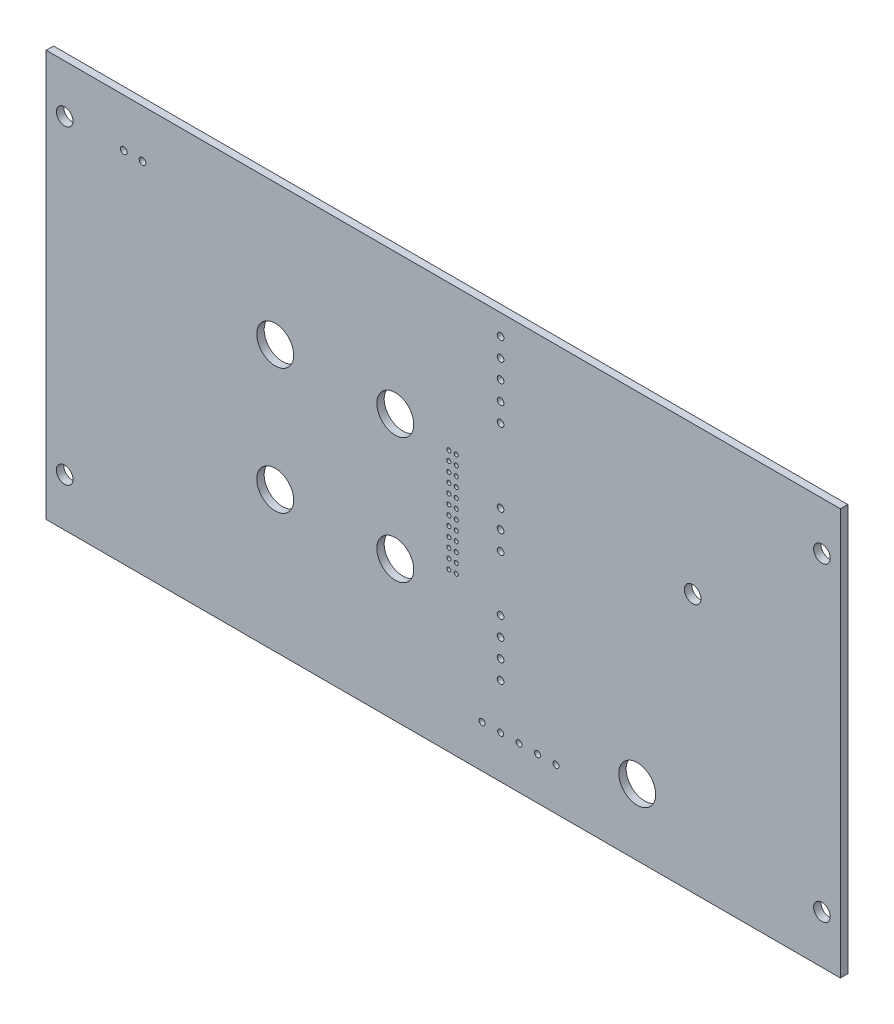
from build123d import *

# Parameters (mm, degrees)
SKETCH_1_W                  = 215
SKETCH_1_H                  = 110
SKETCH_1_R                  = 2.25
SKETCH_1_R_2                = 5
EXTRUDE_1_DEPTH             = 2
SKETCH_3_R                  = 0.55
CUT_EXTRUDE_1_DEPTH         = 2
PATTERN_LINEAR_1_COUNT      = 2
PATTERN_LINEAR_1_PITCH      = 2
PATTERN_LINEAR_1_COUNT_DIR2 = 12
PATTERN_LINEAR_1_PITCH_DIR2 = 2.54
SKETCH_4_R                  = 0.9
SKETCH_4_R_2                = 0.8
CUT_EXTRUDE_2_DEPTH         = 2


with BuildPart() as part:
    # Эскиз1 → Вытянуть1 (new body)
    with BuildSketch(Plane.XY):
        Rectangle(SKETCH_1_W, SKETCH_1_H)
        with Locations((-102.5, 42)):
            Circle(SKETCH_1_R, mode=Mode.SUBTRACT)
        with Locations((102.5, 42)):
            Circle(SKETCH_1_R, mode=Mode.SUBTRACT)
        with Locations((102.5, -42)):
            Circle(SKETCH_1_R, mode=Mode.SUBTRACT)
        with Locations((-102.5, -42)):
            Circle(SKETCH_1_R, mode=Mode.SUBTRACT)
        with Locations((-45.5, 17)):
            Circle(SKETCH_1_R_2, mode=Mode.SUBTRACT)
        with Locations((-13, 17)):
            Circle(SKETCH_1_R_2, mode=Mode.SUBTRACT)
        with Locations((-13, -17)):
            Circle(SKETCH_1_R_2, mode=Mode.SUBTRACT)
        with Locations((-45.5, -17)):
            Circle(SKETCH_1_R_2, mode=Mode.SUBTRACT)
        with Locations((52.5, -37)):
            Circle(SKETCH_1_R_2, mode=Mode.SUBTRACT)
        with Locations((67.5, 15)):
            Circle(SKETCH_1_R, mode=Mode.SUBTRACT)
    extrude(amount=EXTRUDE_1_DEPTH)

    # Эскиз3 → Вырез-Вытянуть1 (cut)
    with BuildSketch(Plane.XY.offset(2)):
        with Locations((1.5, 15.72)):
            Circle(SKETCH_3_R)
    cut_extrude_1 = extrude(amount=-CUT_EXTRUDE_1_DEPTH, mode=Mode.SUBTRACT)

    # Линейный массив1: Cut-Extrude 1 2 × 12
    with Locations(*[(i * PATTERN_LINEAR_1_PITCH, -j * PATTERN_LINEAR_1_PITCH_DIR2, 0) for i in range(PATTERN_LINEAR_1_COUNT) for j in range(PATTERN_LINEAR_1_COUNT_DIR2) if (i, j) != (0, 0)]):
        add(cut_extrude_1, mode=Mode.SUBTRACT)

    # Эскиз4 → Вырез-Вытянуть2 (cut)
    with BuildSketch(Plane.XY.offset(2)):
        with Locations((15.5, 49.4)):
            Circle(SKETCH_4_R)
        with Locations((15.5, 44.32)):
            Circle(SKETCH_4_R)
        with Locations((15.5, 39.24)):
            Circle(SKETCH_4_R)
        with Locations((15.5, 34.16)):
            Circle(SKETCH_4_R)
        with Locations((15.5, 29.08)):
            Circle(SKETCH_4_R)
        with Locations((15.5, -16)):
            Circle(SKETCH_4_R)
        with Locations((15.5, 9.16)):
            Circle(SKETCH_4_R)
        with Locations((15.5, 4.08)):
            Circle(SKETCH_4_R)
        with Locations((15.5, -1)):
            Circle(SKETCH_4_R)
        with Locations((15.5, -31.24)):
            Circle(SKETCH_4_R)
        with Locations((15.5, -21.08)):
            Circle(SKETCH_4_R)
        with Locations((15.5, -26.16)):
            Circle(SKETCH_4_R)
        with Locations((-86.5, 42)):
            Circle(SKETCH_4_R)
        with Locations((-81.42, 42)):
            Circle(SKETCH_4_R)
        with Locations((10.5, -43.5)):
            Circle(SKETCH_4_R_2)
        with Locations((15.5, -43.5)):
            Circle(SKETCH_4_R_2)
        with Locations((20.5, -43.5)):
            Circle(SKETCH_4_R_2)
        with Locations((25.5, -43.5)):
            Circle(SKETCH_4_R_2)
        with Locations((30.5, -43.5)):
            Circle(SKETCH_4_R_2)
    extrude(amount=-CUT_EXTRUDE_2_DEPTH, mode=Mode.SUBTRACT)


solid = part.part
